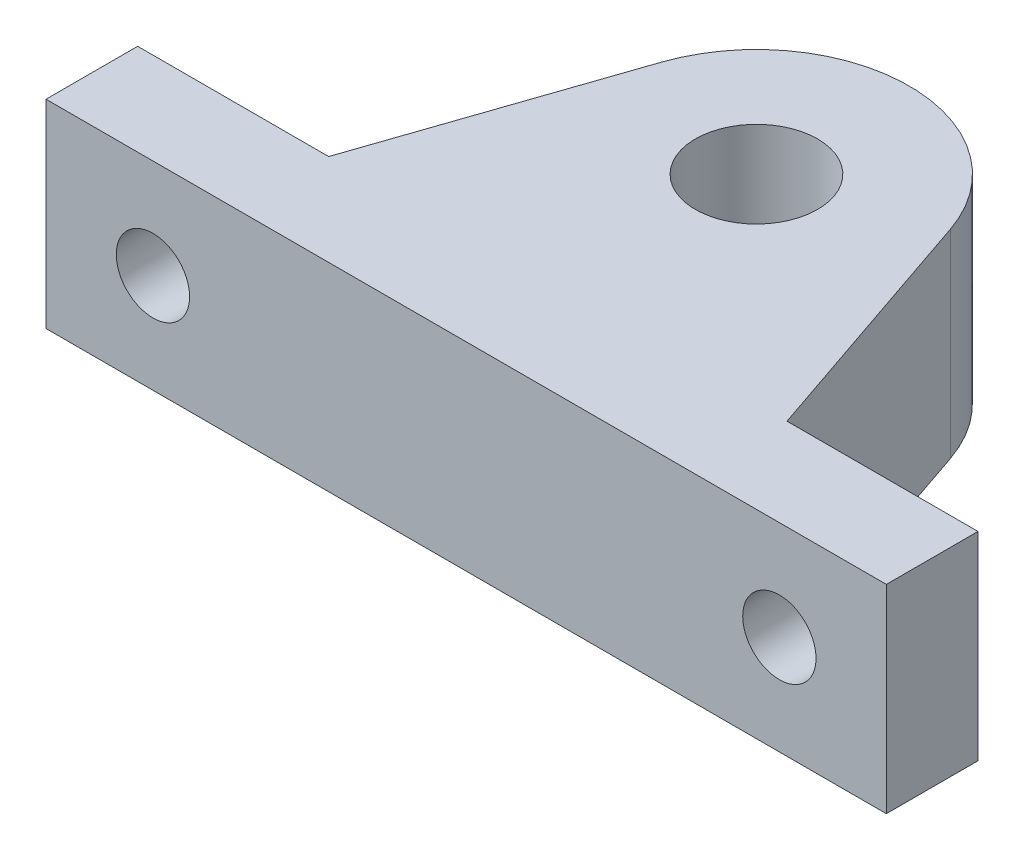
from build123d import *

# Parameters (mm, degrees)
SKETCH_1_R          = 4
EXTRUDE_1_DEPTH     = 6.5
SKETCH_3_R          = 6.5
EXTRUDE_2_DEPTH     = 12
SKETCH_2_R          = 2.4
CUT_EXTRUDE_1_DEPTH = 16
CUT_EXTRUDE_START   = -12
SKETCH_4_R          = 4
CUT_EXTRUDE_2_DEPTH = 12


with BuildPart() as part:
    # 草图1 → 凸台-拉伸1 (new, symmetric)
    with BuildSketch(Plane(origin=(0, 0, 0), x_dir=(1, 0, 0), z_dir=(0, 1, 0))):
        with BuildLine():
            Line((-15, 3), (-9.464557528, 19.228335609))
            ThreePointArc((-9.464557528, 19.228335609), (0, 26), (9.464557528, 19.228335609))
            Line((9.464557528, 19.228335609), (15, 3))
            Line((15, 3), (27.5, 3))
            Line((27.5, 3), (27.5, -3))
            Line((27.5, -3), (-27.5, -3))
            Line((-27.5, -3), (-27.5, 3))
            Line((-27.5, 3), (-15, 3))
        make_face()
        with Locations(Location((0, 16, 0), (0, 0, 90))):
            Circle(SKETCH_1_R, mode=Mode.SUBTRACT)
    extrude(amount=EXTRUDE_1_DEPTH, both=True)

    # 草图3 → 凸台-拉伸2 (add)
    with BuildSketch(Plane(origin=(0, 3.5, 0), x_dir=(1, 0, 0), z_dir=(0, 1, 0))):
        with Locations(Location((0, 16, 0), (0, 0, 270))):
            Circle(SKETCH_3_R)
    extrude(amount=-EXTRUDE_2_DEPTH)

    # 草图2 → 切除-拉伸1 (cut)
    with BuildSketch(Plane(origin=(0, 0, -3), x_dir=(-1, 0, 0), z_dir=(0, 0, -1))):
        with Locations((20.5, 0)):
            Circle(SKETCH_2_R)
        with Locations((-20.5, 0)):
            Circle(SKETCH_2_R)
    extrude(amount=-CUT_EXTRUDE_1_DEPTH, mode=Mode.SUBTRACT)

    # 草图4 → 切除-拉伸2 (cut)
    with BuildSketch(Plane(origin=(0, 3.5, 0), x_dir=(1, 0, 0), z_dir=(0, 1, 0)).offset(CUT_EXTRUDE_START)):
        with Locations(Location((0, 16, 0), (0, 0, 90))):
            Circle(SKETCH_4_R)
    extrude(amount=CUT_EXTRUDE_2_DEPTH, mode=Mode.SUBTRACT)


solid = part.part
